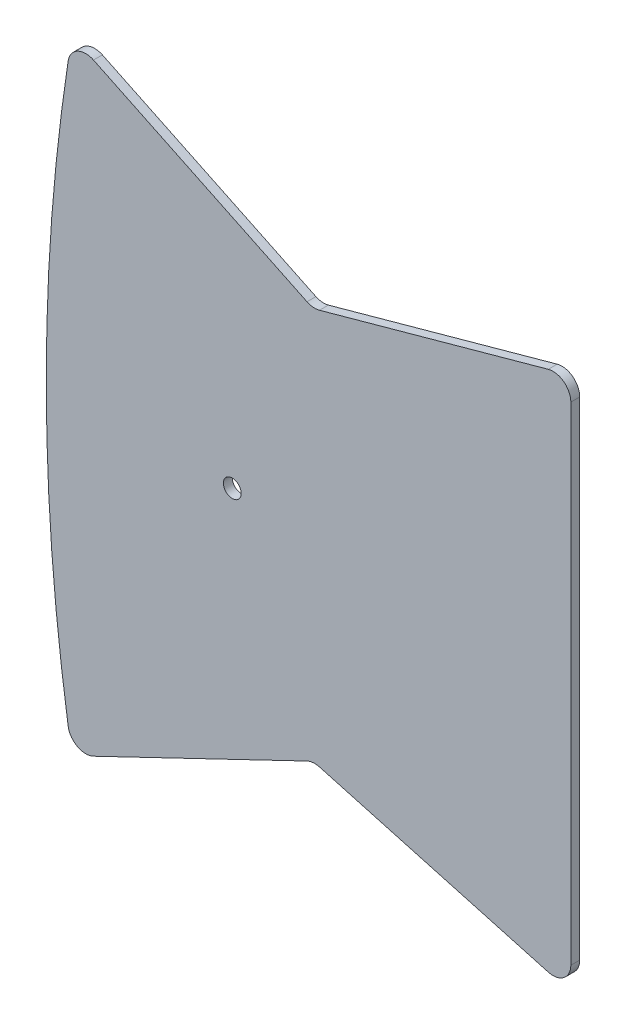
from build123d import *

# Parameters (mm, degrees)
SKETCH1_R           = 3.175
BOSS_EXTRUDE1_DEPTH = 3.175
FILLET1_R           = 6.35


with BuildPart() as part:
    # Sketch1 → Boss-Extrude1 (new body)
    with BuildSketch(Plane.XY):
        with BuildLine():
            Line((-177.8, 111.125), (-91.8765625, 69.85))
            Line((-91.8765625, 69.85), (0, 95.25))
            Line((0, 95.25), (0, -95.25))
            Line((0, -95.25), (-91.8765625, -69.85))
            Line((-91.8765625, -69.85), (-177.8, -111.125))
            ThreePointArc((-177.8, -111.125), (-186.948920727, 0), (-177.8, 111.125))
        make_face()
        with Locations((-120.65, 0)):
            Circle(SKETCH1_R, mode=Mode.SUBTRACT)
    extrude(amount=BOSS_EXTRUDE1_DEPTH)

    # Fillet1
    fillet1_edges = [part.edges().sort_by_distance(p)[0] for p in [
        (-177.8, 111.125, 1.5875),
        (-91.8765625, 69.85, 1.5875),
        (0, 95.25, 1.5875),
        (0, -95.25, 1.5875),
        (-91.8765625, -69.85, 1.5875),
        (-177.8, -111.125, 1.5875),
    ]]
    fillet(fillet1_edges, radius=FILLET1_R)


solid = part.part
